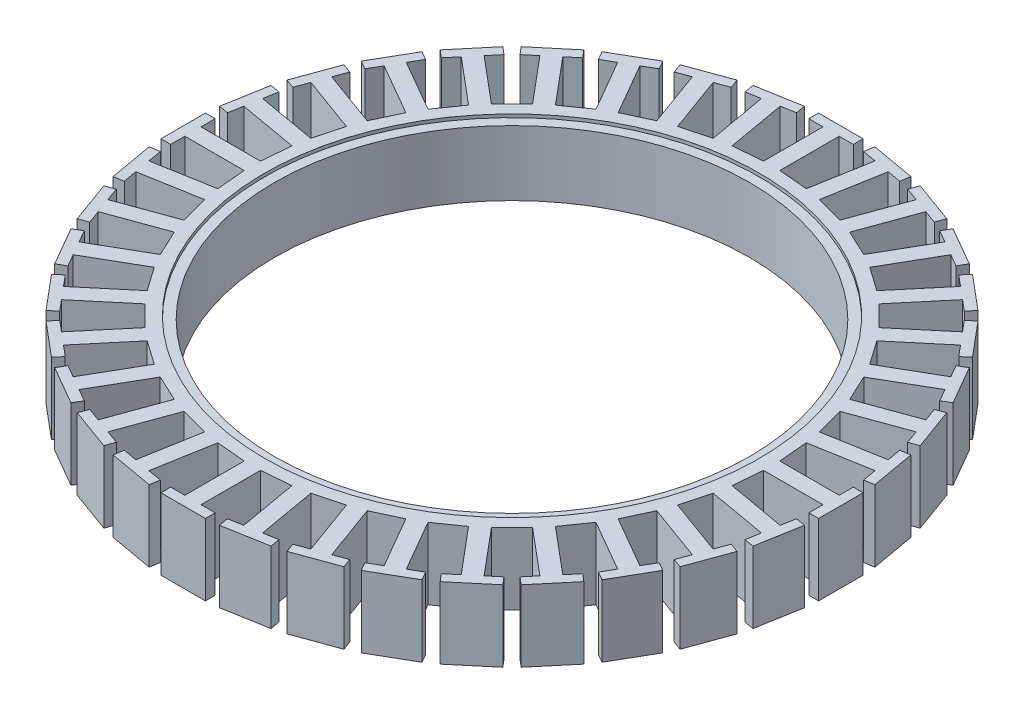
from build123d import *

# Parameters (mm, degrees)
SKETCH1_R           = 30.45
SKETCH1_R_2         = 29.25
BOSS_EXTRUDE1_DEPTH = 4
SKETCH2_R           = 30.45
BOSS_EXTRUDE2_DEPTH = 4.4
CUT_EXTRUDE1_DEPTH  = 8.8


with BuildPart() as part:
    # Sketch1 → Boss-Extrude1 (new, symmetric)
    with BuildSketch(Plane(origin=(0, 0, 0), x_dir=(1, 0, 0), z_dir=(0, 1, 0))):
        with Locations(Location((0, 0, 0), (0, 0, 270))):
            Circle(SKETCH1_R)
        with Locations(Location((0, 0, 0), (0, 0, 270))):
            Circle(SKETCH1_R_2, mode=Mode.SUBTRACT)
    extrude(amount=BOSS_EXTRUDE1_DEPTH, both=True)

    # Sketch2 → Boss-Extrude2 (add, symmetric)
    with BuildSketch(Plane(origin=(0, 0, 0), x_dir=(1, 0, 0), z_dir=(0, 1, 0))):
        Polygon((-3.543290873, 40.5), (-10.522211518, 39.269427994), (-17.181420091, 36.84567429), (-23.318579909, 33.302383417), (-28.747216476, 28.747216476), (-33.302383417, 23.318579909), (-36.84567429, 17.181420091), (-39.269427994, 10.522211518), (-40.5, 3.543290873), (-40.5, -3.543290873), (-39.269427994, -10.522211518), (-36.84567429, -17.181420091), (-33.302383417, -23.318579909), (-28.747216476, -28.747216476), (-23.318579909, -33.302383417), (-17.181420091, -36.84567429), (-10.522211518, -39.269427994), (-3.543290873, -40.5), (3.543290873, -40.5), (10.522211518, -39.269427994), (17.181420091, -36.84567429), (23.318579909, -33.302383417), (28.747216476, -28.747216476), (33.302383417, -23.318579909), (36.84567429, -17.181420091), (39.269427994, -10.522211518), (40.5, -3.543290873), (40.5, 3.543290873), (39.269427994, 10.522211518), (36.84567429, 17.181420091), (33.302383417, 23.318579909), (28.747216476, 28.747216476), (23.318579909, 33.302383417), (17.181420091, 36.84567429), (10.522211518, 39.269427994), (3.543290873, 40.5), align=None)
        with Locations(Location((0, 0, 0), (0, 0, 270))):
            Circle(SKETCH2_R, mode=Mode.SUBTRACT)
    extrude(amount=BOSS_EXTRUDE2_DEPTH, both=True)

    # Sketch4 → Cut-Extrude1 (cut)
    with BuildSketch(Plane(origin=(0, 4.4, 0), x_dir=(1, 0, 0), z_dir=(0, 1, 0))):
        Polygon((1, 39.3), (2.740235003, 39.3), (2.740235003, 40.5), (3.543290873, 40.5), (4.33414652, 40.360550812), (4.125768707, 39.178781508), (5.839565629, 38.876592871), (4.569251962, 31.672286062), (1, 31.984555146), align=None)
        Polygon((7.809181135, 38.529296516), (9.522978058, 38.227107879), (9.731355871, 39.408877182), (10.522211518, 39.269427994), (11.276837193, 38.99476671), (10.866413021, 37.867135565), (12.501699012, 37.27194014), (9.999669514, 30.397670593), (6.538867468, 31.324989707), align=None)
        Polygon((14.381084253, 36.587899854), (16.016370244, 35.992704428), (16.426794416, 37.120335573), (17.181420091, 36.84567429), (17.876886875, 36.444146355), (17.276886875, 35.40491587), (18.783974596, 34.534798369), (15.126252169, 28.199437285), (11.879054756, 29.713630306), align=None)
        Polygon((20.516025404, 33.534798369), (22.023113125, 32.664680867), (22.623113125, 33.703911352), (23.318579909, 33.302383417), (23.933756396, 32.786189054), (23.162411264, 31.866935722), (24.495508618, 30.748334224), (19.793231306, 25.144378345), (16.858302977, 27.199437285), align=None)
        Polygon((26.027597504, 29.462759005), (27.360694857, 28.344157507), (28.132039989, 29.263410839), (28.747216476, 28.747216476), (29.263410839, 28.132039989), (28.344157507, 27.360694857), (29.462759005, 26.027597504), (23.858803126, 21.325320192), (21.325320192, 23.858803126), align=None)
        Polygon((30.748334224, 24.495508618), (31.866935722, 23.162411264), (32.786189054, 23.933756396), (33.302383417, 23.318579909), (33.703911352, 22.623113125), (32.664680867, 22.023113125), (33.534798369, 20.516025404), (27.199437285, 16.858302977), (25.144378345, 19.793231306), align=None)
        Polygon((34.534798369, 18.783974596), (35.40491587, 17.276886875), (36.444146355, 17.876886875), (36.84567429, 17.181420091), (37.120335573, 16.426794416), (35.992704428, 16.016370244), (36.587899854, 14.381084253), (29.713630306, 11.879054756), (28.199437285, 15.126252169), align=None)
        Polygon((37.27194014, 12.501699012), (37.867135565, 10.866413021), (38.99476671, 11.276837193), (39.269427994, 10.522211518), (39.408877182, 9.731355871), (38.227107879, 9.522978058), (38.529296516, 7.809181135), (31.324989707, 6.538867468), (30.397670593, 9.999669514), align=None)
        Polygon((38.876592871, 5.839565629), (39.178781508, 4.125768707), (40.360550812, 4.33414652), (40.5, 3.543290873), (40.5, 2.740235003), (39.3, 2.740235003), (39.3, 1), (31.984555146, 1), (31.672286062, 4.569251962), align=None)
        Polygon((39.3, -1), (39.3, -2.740235003), (40.5, -2.740235003), (40.5, -3.543290873), (40.360550812, -4.33414652), (39.178781508, -4.125768707), (38.876592871, -5.839565629), (31.672286062, -4.569251962), (31.984555146, -1), align=None)
        Polygon((38.529296516, -7.809181135), (38.227107879, -9.522978058), (39.408877182, -9.731355871), (39.269427994, -10.522211518), (38.99476671, -11.276837193), (37.867135565, -10.866413021), (37.27194014, -12.501699012), (30.397670593, -9.999669514), (31.324989707, -6.538867468), align=None)
        Polygon((36.587899854, -14.381084253), (35.992704428, -16.016370244), (37.120335573, -16.426794416), (36.84567429, -17.181420091), (36.444146355, -17.876886875), (35.40491587, -17.276886875), (34.534798369, -18.783974596), (28.199437285, -15.126252169), (29.713630306, -11.879054756), align=None)
        Polygon((33.534798369, -20.516025404), (32.664680867, -22.023113125), (33.703911352, -22.623113125), (33.302383417, -23.318579909), (32.786189054, -23.933756396), (31.866935722, -23.162411264), (30.748334224, -24.495508618), (25.144378345, -19.793231306), (27.199437285, -16.858302977), align=None)
        Polygon((29.462759005, -26.027597504), (28.344157507, -27.360694857), (29.263410839, -28.132039989), (28.747216476, -28.747216476), (28.132039989, -29.263410839), (27.360694857, -28.344157507), (26.027597504, -29.462759005), (21.325320192, -23.858803126), (23.858803126, -21.325320192), align=None)
        Polygon((24.495508618, -30.748334224), (23.162411264, -31.866935722), (23.933756396, -32.786189054), (23.318579909, -33.302383417), (22.623113125, -33.703911352), (22.023113125, -32.664680867), (20.516025404, -33.534798369), (16.858302977, -27.199437285), (19.793231306, -25.144378345), align=None)
        Polygon((18.783974596, -34.534798369), (17.276886875, -35.40491587), (17.876886875, -36.444146355), (17.181420091, -36.84567429), (16.426794416, -37.120335573), (16.016370244, -35.992704428), (14.381084253, -36.587899854), (11.879054756, -29.713630306), (15.126252169, -28.199437285), align=None)
        Polygon((12.501699012, -37.27194014), (10.866413021, -37.867135565), (11.276837193, -38.99476671), (10.522211518, -39.269427994), (9.731355871, -39.408877182), (9.522978058, -38.227107879), (7.809181135, -38.529296516), (6.538867468, -31.324989707), (9.999669514, -30.397670593), align=None)
        Polygon((5.839565629, -38.876592871), (4.125768707, -39.178781508), (4.33414652, -40.360550812), (3.543290873, -40.5), (2.740235003, -40.5), (2.740235003, -39.3), (1, -39.3), (1, -31.984555146), (4.569251962, -31.672286062), align=None)
        Polygon((-1, -39.3), (-2.740235003, -39.3), (-2.740235003, -40.5), (-3.543290873, -40.5), (-4.33414652, -40.360550812), (-4.125768707, -39.178781508), (-5.839565629, -38.876592871), (-4.569251962, -31.672286062), (-1, -31.984555146), align=None)
        Polygon((-7.809181135, -38.529296516), (-9.522978058, -38.227107879), (-9.731355871, -39.408877182), (-10.522211518, -39.269427994), (-11.276837193, -38.99476671), (-10.866413021, -37.867135565), (-12.501699012, -37.27194014), (-9.999669514, -30.397670593), (-6.538867468, -31.324989707), align=None)
        Polygon((-14.381084253, -36.587899854), (-16.016370244, -35.992704428), (-16.426794416, -37.120335573), (-17.181420091, -36.84567429), (-17.876886875, -36.444146355), (-17.276886875, -35.40491587), (-18.783974596, -34.534798369), (-15.126252169, -28.199437285), (-11.879054756, -29.713630306), align=None)
        Polygon((-20.516025404, -33.534798369), (-22.023113125, -32.664680867), (-22.623113125, -33.703911352), (-23.318579909, -33.302383417), (-23.933756396, -32.786189054), (-23.162411264, -31.866935722), (-24.495508618, -30.748334224), (-19.793231306, -25.144378345), (-16.858302977, -27.199437285), align=None)
        Polygon((-26.027597504, -29.462759005), (-27.360694857, -28.344157507), (-28.132039989, -29.263410839), (-28.747216476, -28.747216476), (-29.263410839, -28.132039989), (-28.344157507, -27.360694857), (-29.462759005, -26.027597504), (-23.858803126, -21.325320192), (-21.325320192, -23.858803126), align=None)
        Polygon((-30.748334224, -24.495508618), (-31.866935722, -23.162411264), (-32.786189054, -23.933756396), (-33.302383417, -23.318579909), (-33.703911352, -22.623113125), (-32.664680867, -22.023113125), (-33.534798369, -20.516025404), (-27.199437285, -16.858302977), (-25.144378345, -19.793231306), align=None)
        Polygon((-34.534798369, -18.783974596), (-35.40491587, -17.276886875), (-36.444146355, -17.876886875), (-36.84567429, -17.181420091), (-37.120335573, -16.426794416), (-35.992704428, -16.016370244), (-36.587899854, -14.381084253), (-29.713630306, -11.879054756), (-28.199437285, -15.126252169), align=None)
        Polygon((-37.27194014, -12.501699012), (-37.867135565, -10.866413021), (-38.99476671, -11.276837193), (-39.269427994, -10.522211518), (-39.408877182, -9.731355871), (-38.227107879, -9.522978058), (-38.529296516, -7.809181135), (-31.324989707, -6.538867468), (-30.397670593, -9.999669514), align=None)
        Polygon((-38.876592871, -5.839565629), (-39.178781508, -4.125768707), (-40.360550812, -4.33414652), (-40.5, -3.543290873), (-40.5, -2.740235003), (-39.3, -2.740235003), (-39.3, -1), (-31.984555146, -1), (-31.672286062, -4.569251962), align=None)
        Polygon((-39.3, 1), (-39.3, 2.740235003), (-40.5, 2.740235003), (-40.5, 3.543290873), (-40.360550812, 4.33414652), (-39.178781508, 4.125768707), (-38.876592871, 5.839565629), (-31.672286062, 4.569251962), (-31.984555146, 1), align=None)
        Polygon((-38.529296516, 7.809181135), (-38.227107879, 9.522978058), (-39.408877182, 9.731355871), (-39.269427994, 10.522211518), (-38.99476671, 11.276837193), (-37.867135565, 10.866413021), (-37.27194014, 12.501699012), (-30.397670593, 9.999669514), (-31.324989707, 6.538867468), align=None)
        Polygon((-36.587899854, 14.381084253), (-35.992704428, 16.016370244), (-37.120335573, 16.426794416), (-36.84567429, 17.181420091), (-36.444146355, 17.876886875), (-35.40491587, 17.276886875), (-34.534798369, 18.783974596), (-28.199437285, 15.126252169), (-29.713630306, 11.879054756), align=None)
        Polygon((-33.534798369, 20.516025404), (-32.664680867, 22.023113125), (-33.703911352, 22.623113125), (-33.302383417, 23.318579909), (-32.786189054, 23.933756396), (-31.866935722, 23.162411264), (-30.748334224, 24.495508618), (-25.144378345, 19.793231306), (-27.199437285, 16.858302977), align=None)
        Polygon((-29.462759005, 26.027597504), (-28.344157507, 27.360694857), (-29.263410839, 28.132039989), (-28.747216476, 28.747216476), (-28.132039989, 29.263410839), (-27.360694857, 28.344157507), (-26.027597504, 29.462759005), (-21.325320192, 23.858803126), (-23.858803126, 21.325320192), align=None)
        Polygon((-24.495508618, 30.748334224), (-23.162411264, 31.866935722), (-23.933756396, 32.786189054), (-23.318579909, 33.302383417), (-22.623113125, 33.703911352), (-22.023113125, 32.664680867), (-20.516025404, 33.534798369), (-16.858302977, 27.199437285), (-19.793231306, 25.144378345), align=None)
        Polygon((-18.783974596, 34.534798369), (-17.276886875, 35.40491587), (-17.876886875, 36.444146355), (-17.181420091, 36.84567429), (-16.426794416, 37.120335573), (-16.016370244, 35.992704428), (-14.381084253, 36.587899854), (-11.879054756, 29.713630306), (-15.126252169, 28.199437285), align=None)
        Polygon((-12.501699012, 37.27194014), (-10.866413021, 37.867135565), (-11.276837193, 38.99476671), (-10.522211518, 39.269427994), (-9.731355871, 39.408877182), (-9.522978058, 38.227107879), (-7.809181135, 38.529296516), (-6.538867468, 31.324989707), (-9.999669514, 30.397670593), align=None)
        Polygon((-5.839565629, 38.876592871), (-4.125768707, 39.178781508), (-4.33414652, 40.360550812), (-3.543290873, 40.5), (-2.740235003, 40.5), (-2.740235003, 39.3), (-1, 39.3), (-1, 31.984555146), (-4.569251962, 31.672286062), align=None)
    extrude(amount=-CUT_EXTRUDE1_DEPTH, mode=Mode.SUBTRACT)


solid = part.part
